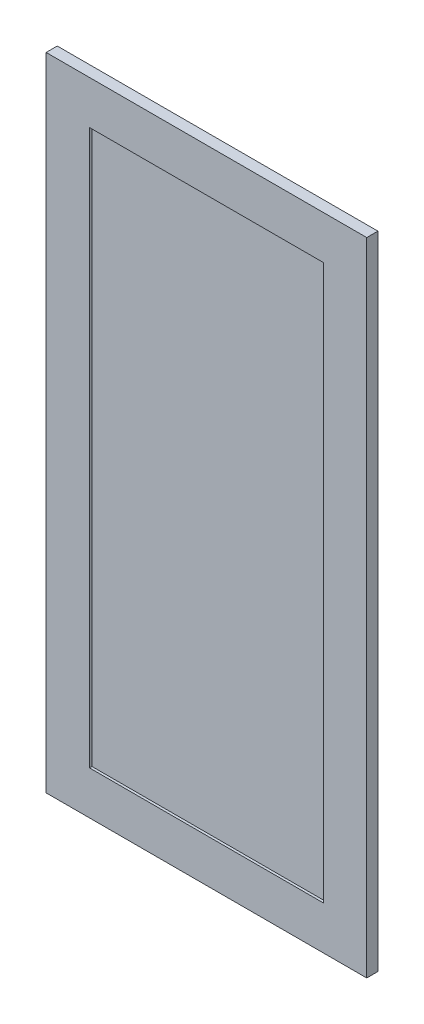
from build123d import *

# Parameters (mm, degrees)
SKETCH1_W           = 518
SKETCH1_H           = 1036
BOSS_EXTRUDE1_DEPTH = 18
SKETCH2_W           = 378
SKETCH2_H           = 896
CUT_EXTRUDE1_DEPTH  = 4


with BuildPart() as part:
    # Sketch1 → Boss-Extrude1 (new body)
    with BuildSketch(Plane.XY):
        Rectangle(SKETCH1_W, SKETCH1_H)
    extrude(amount=BOSS_EXTRUDE1_DEPTH)

    # Sketch2 → Cut-Extrude1 (cut)
    with BuildSketch(Plane.XY.offset(18)):
        Rectangle(SKETCH2_W, SKETCH2_H)
    extrude(amount=-CUT_EXTRUDE1_DEPTH, mode=Mode.SUBTRACT)


solid = part.part
